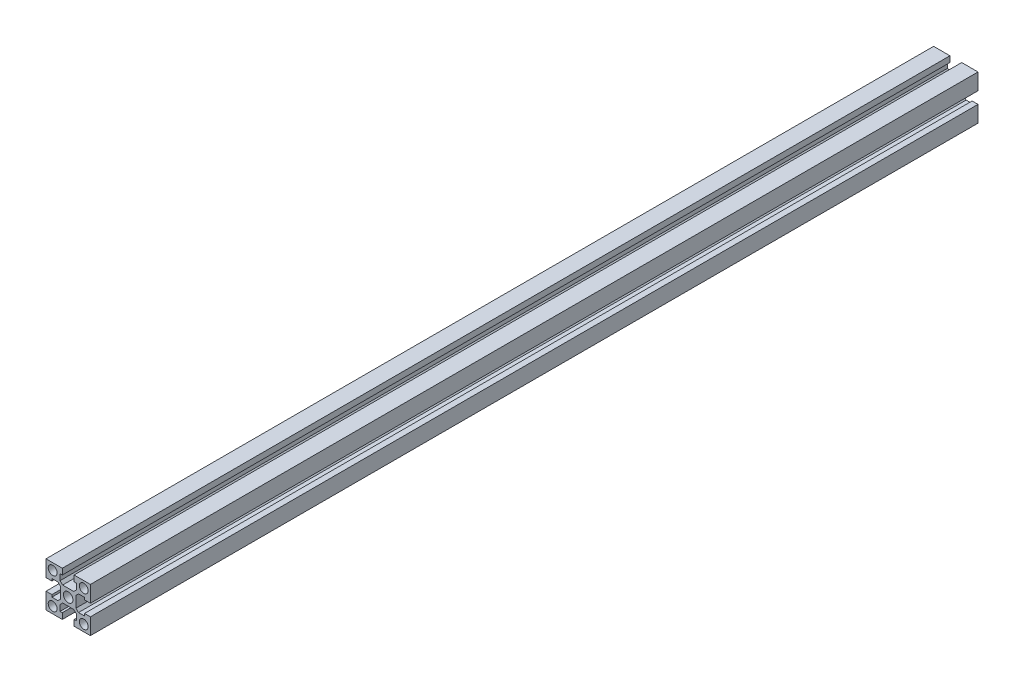
from build123d import *

# Parameters (mm, degrees)
SKETCH_1_R      = 2
SKETCH_1_R_2    = 2.15
EXTRUDE_1_DEPTH = 200


with BuildPart() as part:
    # 스케치1 → 보스-돌출1 (new, symmetric)
    with BuildSketch(Plane.XY):
        Polygon((-10, -10), (-2.65, -10), (-2.65, -7.35), (-3.65, -7.35), (-3.65, -4.639949494), (-2.510050506, -3.5), (0, -3.5), (2.510050506, -3.5), (3.65, -4.639949494), (3.65, -7.35), (2.65, -7.35), (2.65, -10), (10, -10), (10, -2.65), (7.35, -2.65), (7.35, -3.65), (4.639949494, -3.65), (3.5, -2.510050506), (3.5, 0), (3.5, 2.510050506), (4.639949494, 3.65), (7.35, 3.65), (7.35, 2.65), (10, 2.65), (10, 10), (2.65, 10), (2.65, 7.35), (3.65, 7.35), (3.65, 4.639949494), (2.510050506, 3.5), (0, 3.5), (-2.510050506, 3.5), (-3.65, 4.639949494), (-3.65, 7.35), (-2.65, 7.35), (-2.65, 10), (-10, 10), (-10, 2.65), (-7.35, 2.65), (-7.35, 3.65), (-4.639949494, 3.65), (-3.5, 2.510050506), (-3.5, 0), (-3.5, -2.510050506), (-4.639949494, -3.65), (-7.35, -3.65), (-7.35, -2.65), (-10, -2.65), align=None)
        with Locations((-7, 7)):
            Circle(SKETCH_1_R, mode=Mode.SUBTRACT)
        Circle(SKETCH_1_R_2, mode=Mode.SUBTRACT)
        with Locations((7, 7)):
            Circle(SKETCH_1_R, mode=Mode.SUBTRACT)
        with Locations((-7, -7)):
            Circle(SKETCH_1_R, mode=Mode.SUBTRACT)
        with Locations((7, -7)):
            Circle(SKETCH_1_R, mode=Mode.SUBTRACT)
    extrude(amount=EXTRUDE_1_DEPTH, both=True)


solid = part.part
